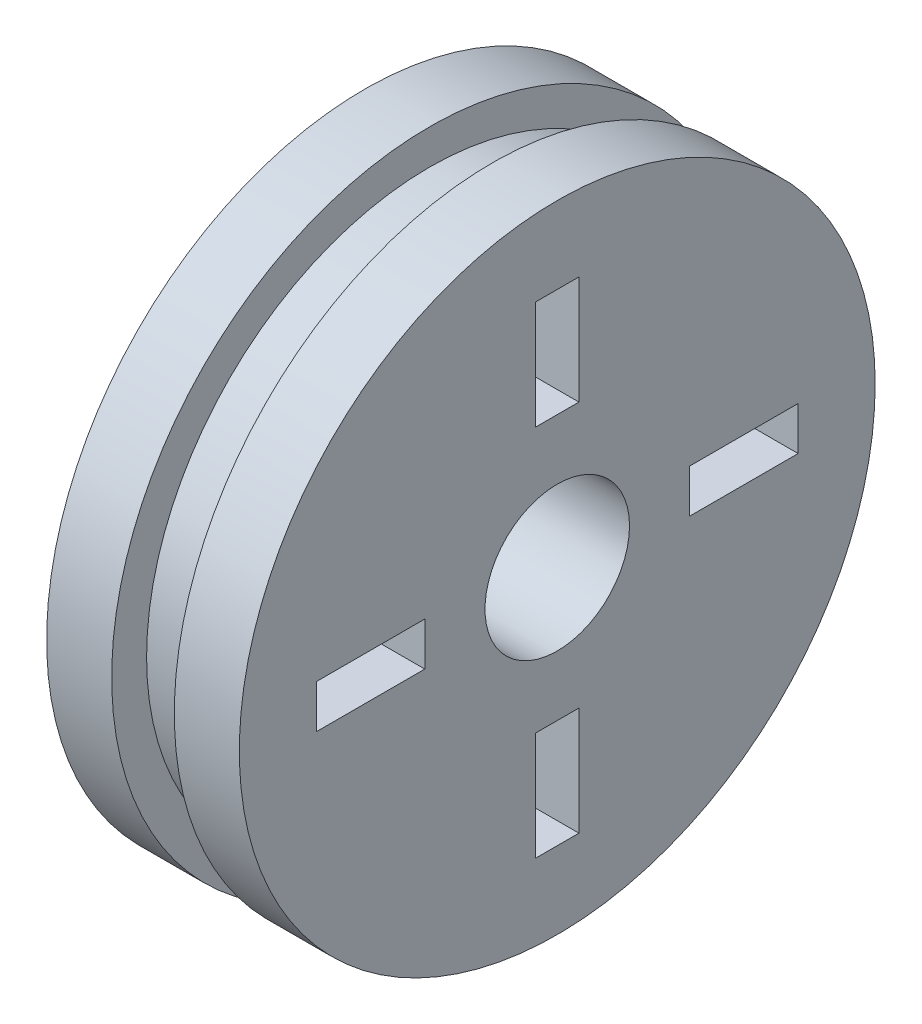
from build123d import *

# Parameters (mm, degrees)
BOSS_EXTRUDE1_START  = 77.2
SKETCH1_R            = 13.2
BOSS_EXTRUDE1_DEPTH  = 8
BOSS_EXTRUDE2_START  = 79.9
SKETCH2_R            = 20
BOSS_EXTRUDE2_DEPTH  = 2.6
BOSS_EXTRUDE3_START  = 79.9
SKETCH3_R            = 11.75
BOSS_EXTRUDE3_DEPTH  = 2.6
BOSS_EXTRUDE4_START  = 76.7
SKETCH4_R            = 4.6
BOSS_EXTRUDE4_DEPTH  = 2.3
BOSS_EXTRUDE5_START  = -55.3
SKETCH5_W            = 2.3
SKETCH5_H            = 11.5
BOSS_EXTRUDE5_DEPTH  = 6.6
BOSS_EXTRUDE6_START  = -52.9
SKETCH6_W            = 10
SKETCH6_H            = 4.5
BOSS_EXTRUDE6_DEPTH  = 1.8
BOSS_EXTRUDE7_START  = -55.3
SKETCH7_W            = 2.3
SKETCH7_H            = 11.5
BOSS_EXTRUDE7_DEPTH  = 6.6
BOSS_EXTRUDE8_START  = -52.9
SKETCH8_W            = 10
SKETCH8_H            = 4.5
BOSS_EXTRUDE8_DEPTH  = 1.8
BOSS_EXTRUDE9_START  = -52
SKETCH9_W            = 2.3
SKETCH9_H            = 6.6
BOSS_EXTRUDE9_DEPTH  = 11.5
BOSS_EXTRUDE10_START = -46.5
SKETCH10_W           = 10
SKETCH10_H           = 1.8
BOSS_EXTRUDE10_DEPTH = 4.5
BOSS_EXTRUDE11_START = -63.5
SKETCH11_W           = 2.3
SKETCH11_H           = 6.6
BOSS_EXTRUDE11_DEPTH = 11.5
BOSS_EXTRUDE12_START = -62
SKETCH12_W           = 10
SKETCH12_H           = 1.8
BOSS_EXTRUDE12_DEPTH = 4.5
BOSS_EXTRUDE13_START = 76.2
SKETCH13_R           = 3
BOSS_EXTRUDE13_DEPTH = 10


with BuildPart() as part:
    # Sketch1 → Boss-Extrude1 (new body)
    with BuildSketch(Plane(origin=(0, 0, 0), x_dir=(0, 0, -1), z_dir=(1, 0, 0)).offset(BOSS_EXTRUDE1_START)):
        with Locations((52, -65)):
            Circle(SKETCH1_R)
    extrude(amount=BOSS_EXTRUDE1_DEPTH)


with BuildPart() as body_2:
    # Sketch2 → Boss-Extrude2 (new body)
    with BuildSketch(Plane(origin=(0, 0, 0), x_dir=(0, 0, -1), z_dir=(1, 0, 0)).offset(BOSS_EXTRUDE2_START)):
        with Locations((52, -65)):
            Circle(SKETCH2_R)
    extrude(amount=BOSS_EXTRUDE2_DEPTH)


with BuildPart() as part_1:
    add(part.part)

    # Combine1: cut body 2
    add(body_2.part, mode=Mode.SUBTRACT)

    # Sketch3 → Boss-Extrude3 (add)
    with BuildSketch(Plane(origin=(0, 0, 0), x_dir=(0, 0, -1), z_dir=(1, 0, 0)).offset(BOSS_EXTRUDE3_START)):
        with Locations((52, -65)):
            Circle(SKETCH3_R)
    extrude(amount=BOSS_EXTRUDE3_DEPTH)


with BuildPart() as body_2_2:
    # Sketch4 → Boss-Extrude4 (new body)
    with BuildSketch(Plane(origin=(0, 0, 0), x_dir=(0, 0, -1), z_dir=(1, 0, 0)).offset(BOSS_EXTRUDE4_START)):
        with Locations((52, -65)):
            Circle(SKETCH4_R)
    extrude(amount=BOSS_EXTRUDE4_DEPTH)


with BuildPart() as part_2:
    add(part_1.part)

    # Combine2: cut body 2 2
    add(body_2_2.part, mode=Mode.SUBTRACT)


with BuildPart() as body_2_3:
    # Sketch5 → Boss-Extrude5 (new body)
    with BuildSketch(Plane.XY.offset(BOSS_EXTRUDE5_START)):
        with Locations((77.85, -59.25)):
            Rectangle(SKETCH5_W, SKETCH5_H)
    extrude(amount=BOSS_EXTRUDE5_DEPTH)


with BuildPart() as part_3:
    add(part_2.part)

    # Combine3: cut body 2 3
    add(body_2_3.part, mode=Mode.SUBTRACT)


with BuildPart() as body_2_4:
    # Sketch6 → Boss-Extrude6 (new body)
    with BuildSketch(Plane.XY.offset(BOSS_EXTRUDE6_START)):
        with Locations((81.2, -57.25)):
            Rectangle(SKETCH6_W, SKETCH6_H)
    extrude(amount=BOSS_EXTRUDE6_DEPTH)


with BuildPart() as part_4:
    add(part_3.part)

    # Combine4: cut body 2 4
    add(body_2_4.part, mode=Mode.SUBTRACT)


with BuildPart() as body_2_5:
    # Sketch7 → Boss-Extrude7 (new body)
    with BuildSketch(Plane.XY.offset(BOSS_EXTRUDE7_START)):
        with Locations((77.85, -70.75)):
            Rectangle(SKETCH7_W, SKETCH7_H)
    extrude(amount=BOSS_EXTRUDE7_DEPTH)


with BuildPart() as part_5:
    add(part_4.part)

    # Combine5: cut body 2 5
    add(body_2_5.part, mode=Mode.SUBTRACT)


with BuildPart() as body_2_6:
    # Sketch8 → Boss-Extrude8 (new body)
    with BuildSketch(Plane.XY.offset(BOSS_EXTRUDE8_START)):
        with Locations((81.2, -72.75)):
            Rectangle(SKETCH8_W, SKETCH8_H)
    extrude(amount=BOSS_EXTRUDE8_DEPTH)


with BuildPart() as part_6:
    add(part_5.part)

    # Combine6: cut body 2 6
    add(body_2_6.part, mode=Mode.SUBTRACT)


with BuildPart() as body_2_7:
    # Sketch9 → Boss-Extrude9 (new body)
    with BuildSketch(Plane.XY.offset(BOSS_EXTRUDE9_START)):
        with Locations((77.85, -65)):
            Rectangle(SKETCH9_W, SKETCH9_H)
    extrude(amount=BOSS_EXTRUDE9_DEPTH)


with BuildPart() as part_7:
    add(part_6.part)

    # Combine7: cut body 2 7
    add(body_2_7.part, mode=Mode.SUBTRACT)


with BuildPart() as body_2_8:
    # Sketch10 → Boss-Extrude10 (new body)
    with BuildSketch(Plane.XY.offset(BOSS_EXTRUDE10_START)):
        with Locations((81.2, -65)):
            Rectangle(SKETCH10_W, SKETCH10_H)
    extrude(amount=BOSS_EXTRUDE10_DEPTH)


with BuildPart() as part_8:
    add(part_7.part)

    # Combine8: cut body 2 8
    add(body_2_8.part, mode=Mode.SUBTRACT)


with BuildPart() as body_2_9:
    # Sketch11 → Boss-Extrude11 (new body)
    with BuildSketch(Plane.XY.offset(BOSS_EXTRUDE11_START)):
        with Locations((77.85, -65)):
            Rectangle(SKETCH11_W, SKETCH11_H)
    extrude(amount=BOSS_EXTRUDE11_DEPTH)


with BuildPart() as part_9:
    add(part_8.part)

    # Combine9: cut body 2 9
    add(body_2_9.part, mode=Mode.SUBTRACT)


with BuildPart() as body_2_10:
    # Sketch12 → Boss-Extrude12 (new body)
    with BuildSketch(Plane.XY.offset(BOSS_EXTRUDE12_START)):
        with Locations((81.2, -65)):
            Rectangle(SKETCH12_W, SKETCH12_H)
    extrude(amount=BOSS_EXTRUDE12_DEPTH)


with BuildPart() as part_10:
    add(part_9.part)

    # Combine10: cut body 2 10
    add(body_2_10.part, mode=Mode.SUBTRACT)


with BuildPart() as body_2_11:
    # Sketch13 → Boss-Extrude13 (new body)
    with BuildSketch(Plane(origin=(0, 0, 0), x_dir=(0, 0, -1), z_dir=(1, 0, 0)).offset(BOSS_EXTRUDE13_START)):
        with Locations((52, -65)):
            Circle(SKETCH13_R)
    extrude(amount=BOSS_EXTRUDE13_DEPTH)


with BuildPart() as part_11:
    add(part_10.part)

    # Combine11: cut body 2 11
    add(body_2_11.part, mode=Mode.SUBTRACT)


solid = part_11.part
